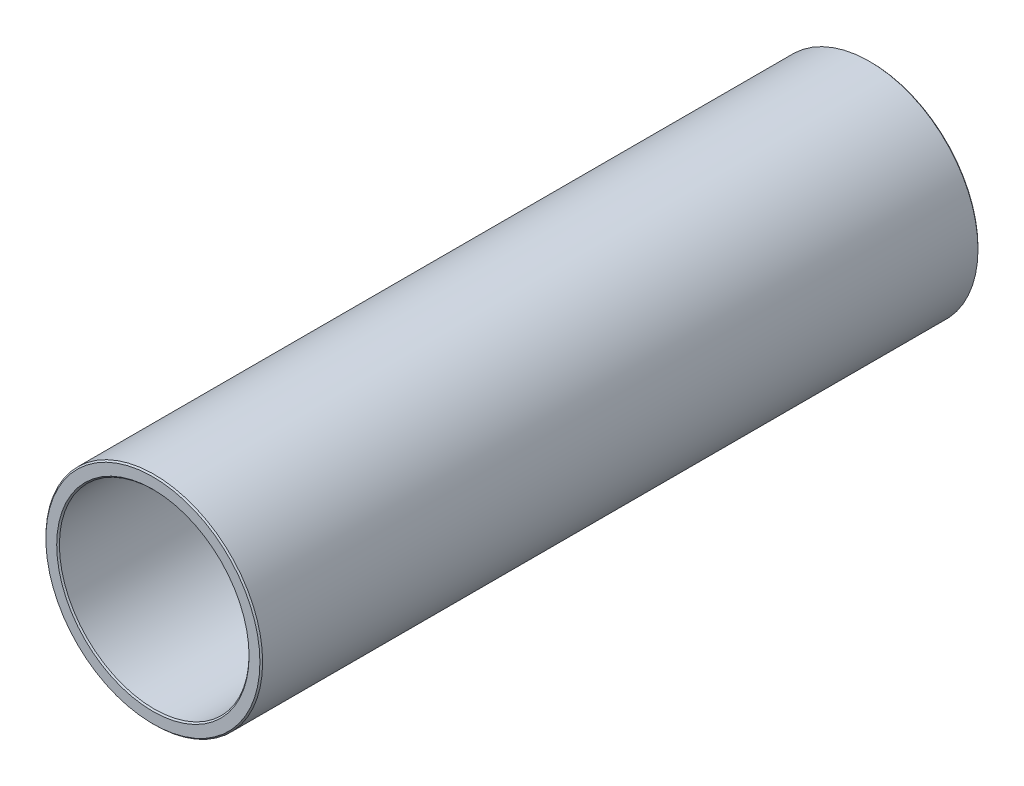
from build123d import *

# Parameters (mm, degrees)
SKETCH1_R      = 8
SKETCH1_R_2    = 7
EXTRUDE1_DEPTH = 53
CHAMFER1_SIZE  = 0.1


with BuildPart() as part:
    # Sketch1 → Extrude1 (new body)
    with BuildSketch(Plane.XY):
        Circle(SKETCH1_R)
        Circle(SKETCH1_R_2, mode=Mode.SUBTRACT)
    extrude(amount=EXTRUDE1_DEPTH)

    # Chamfer1
    chamfer1_edges = [part.edges().sort_by_distance(p)[0] for p in [
        (-8, 0, 0),
        (-8, 0, 53),
        (-7, 0, 0),
        (-7, 0, 53),
    ]]
    chamfer(chamfer1_edges, length=CHAMFER1_SIZE)


solid = part.part
